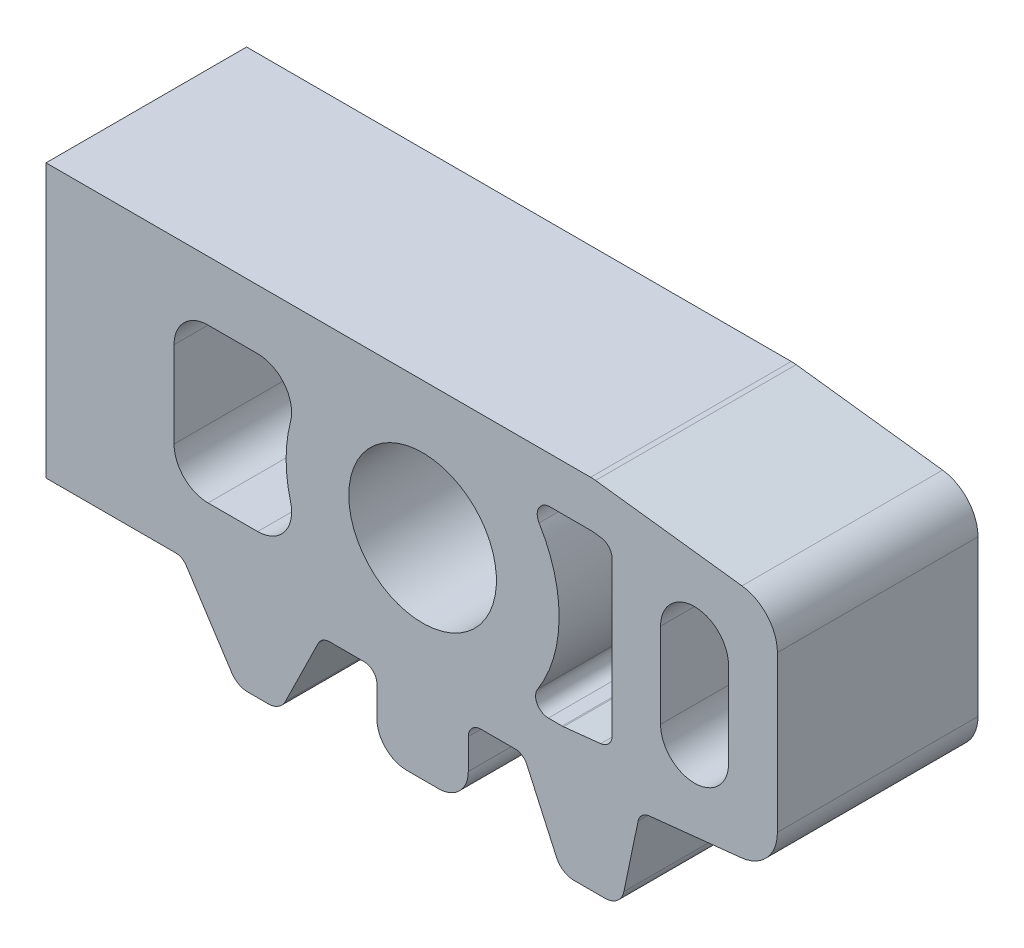
from build123d import *

# Parameters (mm, degrees)
BOSS_EXTRUDE1_DEPTH      = 31.4325
BOSS_EXTRUDE1_DEPTH_BACK = 28.521152
SKETCH1_R                = 22.06625


with BuildPart() as part:
    # Sketch1 → Boss-Extrude1 (new, two sides: drawn at the far end of the back side and taken through both)
    with BuildSketch(Plane.XY.offset(-BOSS_EXTRUDE1_DEPTH_BACK)):
        with BuildLine():
            Line((-112.5601, 40.79875), (-112.5601, -40.79875))
            Line((-112.5601, -40.79875), (-105.64544448, -40.79875))
            Line((-105.64544448, -40.79875), (-78.272997716, -40.79875))
            Line((-78.272997716, -40.79875), (-73.818843223, -40.79875))
            ThreePointArc((-73.818843223, -40.79875), (-72.740595899, -40.954508258), (-71.750509166, -41.40904779))
            ThreePointArc((-71.750509166, -41.40904779), (-71.12778643, -41.911656502), (-70.623783626, -42.533251464))
            Line((-70.623783626, -42.533251464), (-57.043977681, -63.438247804))
            ThreePointArc((-57.043977681, -63.438247804), (-54.978017505, -65.347620641), (-52.251388286, -66.04))
            Line((-52.251388286, -66.04), (-46.145505176, -66.04))
            ThreePointArc((-46.145505176, -66.04), (-43.125397449, -65.176821752), (-41.017587638, -62.848031257))
            Line((-41.017587638, -62.848031257), (-31.215934729, -42.926729162))
            ThreePointArc((-31.215934729, -42.926729162), (-29.810728189, -41.374202165), (-27.797323037, -40.79875))
            Line((-27.797323037, -40.79875), (-17.4625, -40.79875))
            ThreePointArc((-17.4625, -40.79875), (-14.768423164, -41.914673164), (-13.6525, -44.60875))
            Line((-13.6525, -44.60875), (-13.6525, -53.6575))
            ThreePointArc((-13.6525, -53.6575), (-11.048679285, -59.943679285), (-4.7625, -62.5475))
            Line((-4.7625, -62.5475), (4.7625, -62.5475))
            ThreePointArc((4.7625, -62.5475), (11.048679285, -59.943679285), (13.6525, -53.6575))
            Line((13.6525, -53.6575), (13.6525, -44.60875))
            ThreePointArc((13.6525, -44.60875), (14.768423164, -41.914673164), (17.4625, -40.79875))
            Line((17.4625, -40.79875), (27.654758859, -40.79875))
            ThreePointArc((27.654758859, -40.79875), (29.719716377, -41.406867671), (31.125494286, -43.037096222))
            Line((31.125494286, -43.037096222), (40.021517431, -62.682480667))
            ThreePointArc((40.021517431, -62.682480667), (42.130184293, -65.127823493), (45.227620571, -66.04))
            Line((45.227620571, -66.04), (54.568047284, -66.04))
            ThreePointArc((54.568047284, -66.04), (58.173789295, -64.758942889), (60.163026865, -61.49008733))
            Line((60.163026865, -61.49008733), (64.407842813, -41.105642371))
            ThreePointArc((64.407842813, -41.105642371), (65.581423361, -39.0573205), (67.73644034, -38.093569694))
            Line((67.73644034, -38.093569694), (95.251064725, -35.178643905))
            ThreePointArc((95.251064725, -35.178643905), (102.949381832, -31.250135269), (106.045, -23.180784951))
            Line((106.045, -23.180784951), (106.045, 23.328923197))
            ThreePointArc((106.045, 23.328923197), (103.018943576, 31.320276275), (95.45872167, 35.302962082))
            Line((95.45872167, 35.302962082), (51.692807067, 40.707788885))
            ThreePointArc((51.692807067, 40.707788885), (50.954843743, 40.77598825), (50.214085398, 40.79875))
            Line((50.214085398, 40.79875), (-70.371619795, 40.79875))
            Line((-70.371619795, 40.79875), (-78.272997716, 40.79875))
            Line((-78.272997716, 40.79875), (-105.64544448, 40.79875))
            Line((-105.64544448, 40.79875), (-112.5601, 40.79875))
        make_face()
        with Locations(Location((0, 0, 0), (0, 0, 180))):
            Circle(SKETCH1_R, mode=Mode.SUBTRACT)
        with BuildLine():
            Line((51.310190607, -26.854733006), (52.037693166, -26.777660684))
            Line((52.037693166, -26.777660684), (53.233388861, -26.650987532))
            ThreePointArc((53.233388861, -26.650987532), (55.664436368, -25.410405857), (56.642, -22.862189968))
            Line((56.642, -22.862189968), (56.642, 22.960948798))
            ThreePointArc((56.642, 22.960948798), (55.686403235, 25.484533981), (53.298964738, 26.742224235))
            Line((53.298964738, 26.742224235), (51.93932935, 26.910131015))
            Line((51.93932935, 26.910131015), (51.211826791, 26.999973199))
            Line((51.211826791, 26.999973199), (50.876355003, 27.041401943))
            ThreePointArc((50.876355003, 27.041401943), (50.643313953, 27.062938585), (50.409390265, 27.070126506))
            Line((50.409390265, 27.070126506), (43.95784943, 27.070126506))
            Line((43.95784943, 27.070126506), (38.064512232, 27.070126506))
            ThreePointArc((38.064512232, 27.070126506), (34.741474437, 25.123864634), (34.813450689, 21.273496484))
            ThreePointArc((34.813450689, 21.273496484), (40.796592197, -0.419602974), (34.368525909, -21.985050111))
            ThreePointArc((34.368525909, -21.985050111), (34.236008022, -25.867591825), (37.578038056, -27.848128721))
            Line((37.578038056, -27.848128721), (41.732055975, -27.848128721))
            ThreePointArc((41.732055975, -27.848128721), (41.933030203, -27.84282442), (42.133444836, -27.826926285))
            Line((42.133444836, -27.826926285), (43.35576614, -27.69743239))
            Line((43.35576614, -27.69743239), (51.310190607, -26.854733006))
        make_face(mode=Mode.SUBTRACT)
        with BuildLine():
            Line((-49.309702392, 23.01875), (-64.127923903, 23.01875))
            ThreePointArc((-64.127923903, 23.01875), (-66.710199181, 22.685115268), (-69.122880616, 21.706122911))
            ThreePointArc((-69.122880616, 21.706122911), (-72.902157779, 17.981095156), (-74.287923903, 12.85875))
            Line((-74.287923903, 12.85875), (-74.287923903, -12.85875))
            ThreePointArc((-74.287923903, -12.85875), (-72.902157779, -17.981095156), (-69.122880616, -21.706122911))
            ThreePointArc((-69.122880616, -21.706122911), (-66.710199181, -22.685115268), (-64.127923903, -23.01875))
            Line((-64.127923903, -23.01875), (-49.309702392, -23.01875))
            ThreePointArc((-49.309702392, -23.01875), (-41.270013925, -19.07075526), (-39.47848447, -10.295011682))
            ThreePointArc((-39.47848447, -10.295011682), (-40.79875, 0), (-39.47848447, 10.295011682))
            ThreePointArc((-39.47848447, 10.295011682), (-41.270013925, 19.07075526), (-49.309702392, 23.01875))
        make_face(mode=Mode.SUBTRACT)
        with BuildLine():
            Line((71.12, 12.7), (71.12, -12.7))
            ThreePointArc((71.12, -12.7), (71.199051629, -13.96494266), (71.434976365, -15.210201111))
            ThreePointArc((71.434976365, -15.210201111), (82.54494266, -22.780948371), (91.44, -12.7))
            Line((91.44, -12.7), (91.44, 12.7))
            ThreePointArc((91.44, 12.7), (82.54494266, 22.780948371), (71.434976365, 15.210201111))
            ThreePointArc((71.434976365, 15.210201111), (71.199051629, 13.96494266), (71.12, 12.7))
        make_face(mode=Mode.SUBTRACT)
    extrude(amount=BOSS_EXTRUDE1_DEPTH + BOSS_EXTRUDE1_DEPTH_BACK)


solid = part.part
